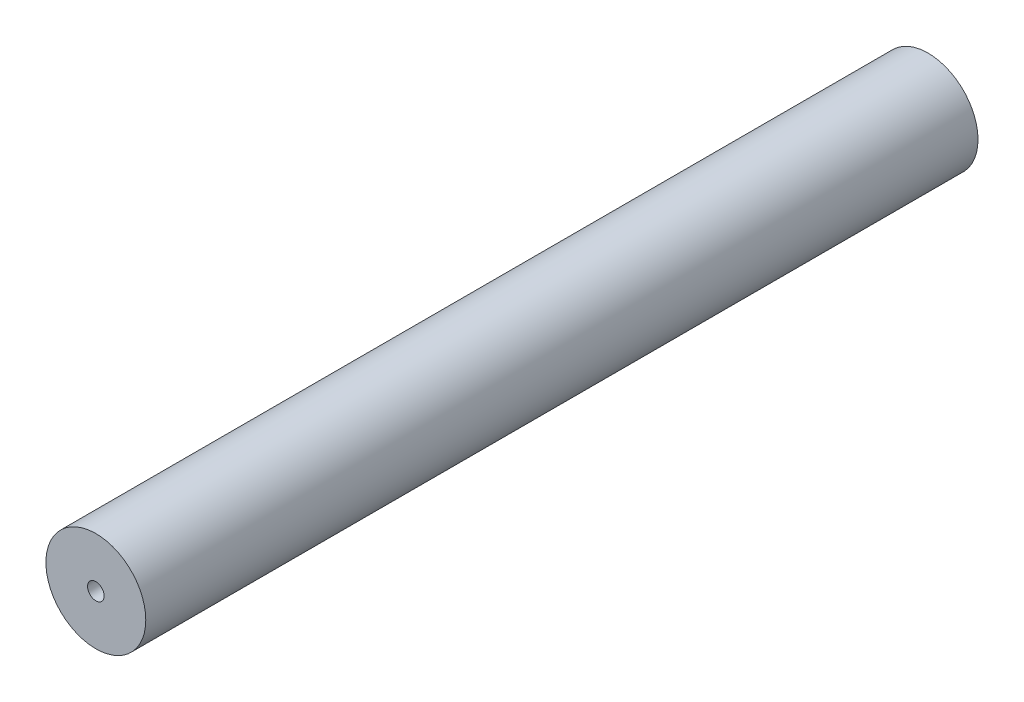
from build123d import *

# Parameters (mm, degrees)
ESQUISSE1_R        = 30
ESQUISSE1_R_2      = 5
BOSS_EXTRU_1_DEPTH = 500


with BuildPart() as part:
    # Esquisse1 → Boss.-Extru.1 (new body)
    with BuildSketch(Plane.XY):
        Circle(ESQUISSE1_R)
        Circle(ESQUISSE1_R_2, mode=Mode.SUBTRACT)
    extrude(amount=BOSS_EXTRU_1_DEPTH)


solid = part.part
